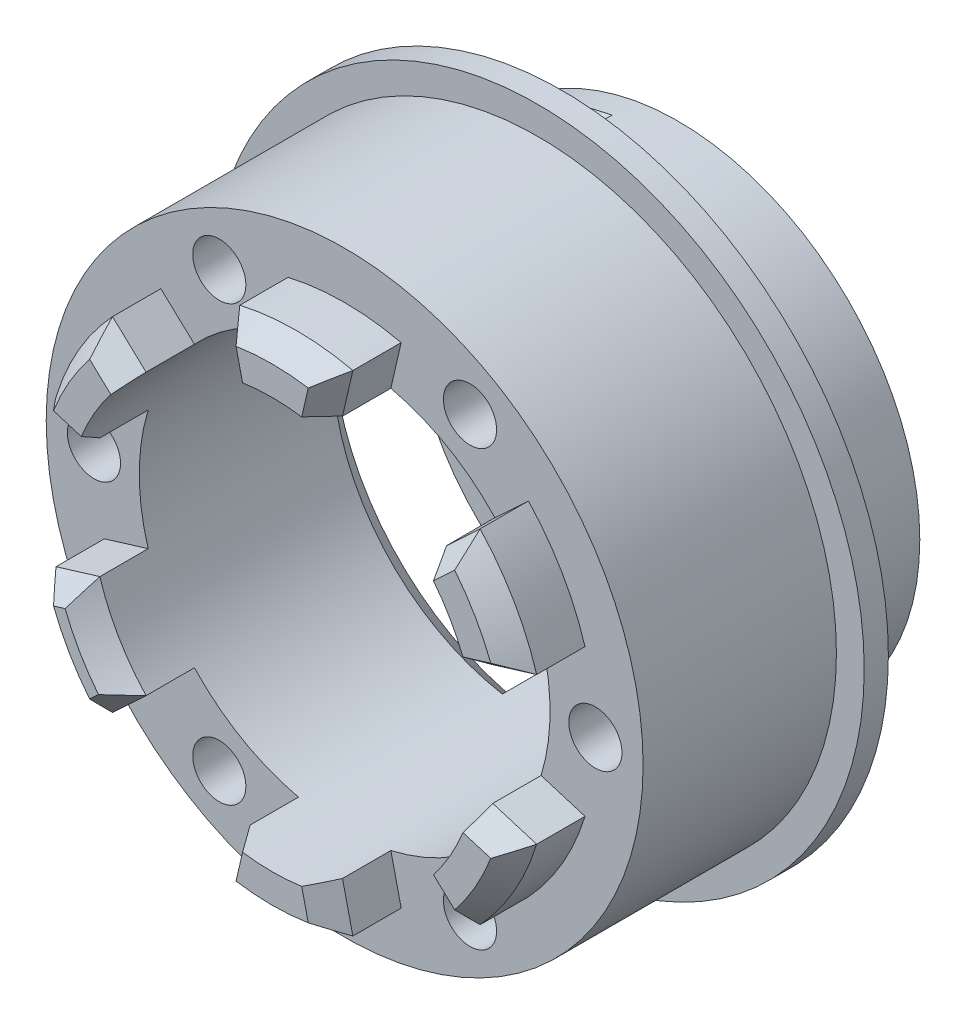
from build123d import *
from OCP.BRepFilletAPI import BRepFilletAPI_MakeChamfer
from build123d.topology import SkipClean

# Parameters (mm, degrees)
SKETCH_1_R          = 10
EXTRUDE_1_DEPTH     = 2
SKETCH_2_R          = 10
SKETCH_2_R_2        = 8.5
EXTRUDE_2_DEPTH     = 2.8
SKETCH_4_R          = 13.5
SKETCH_4_R_2        = 8.5
EXTRUDE_3_DEPTH     = 1
SKETCH_5_R          = 12.35
SKETCH_5_R_2        = 8.5
EXTRUDE_4_DEPTH     = 8
SKETCH_6_R          = 1.1
CUT_EXTRUDE_1_DEPTH = 8
SKETCH_7_R          = 3
SKETCH_7_R_2        = 1.15
CUT_EXTRUDE_2_DEPTH = 24.557164515
EXTRUDE_5_DEPTH     = 3
CHAMFER_1_SIZE      = 1
CHAMFER_1_SIZE2     = 0.700207538
CUT_EXTRUDE_START   = -2
CUT_EXTRUDE_3_DEPTH = 2.8
CHAMFER_2_SIZE      = 1


with BuildPart() as part:
    # 스케치1 → 보스-돌출1 (new body)
    with BuildSketch(Plane.XY):
        Circle(SKETCH_1_R)
    extrude(amount=EXTRUDE_1_DEPTH)

    # 스케치2 → 보스-돌출2 (add)
    with BuildSketch(Plane.XY.offset(2)):
        Circle(SKETCH_2_R)
        Circle(SKETCH_2_R_2, mode=Mode.SUBTRACT)
    extrude(amount=EXTRUDE_2_DEPTH)

    # 스케치4 → 보스-돌출3 (add)
    with BuildSketch(Plane.XY.offset(4.8)):
        Circle(SKETCH_4_R)
        Circle(SKETCH_4_R_2, mode=Mode.SUBTRACT)
    extrude(amount=EXTRUDE_3_DEPTH)

    # 스케치5 → 보스-돌출4 (add)
    with BuildSketch(Plane.XY.offset(5.8)):
        Circle(SKETCH_5_R)
        Circle(SKETCH_5_R_2, mode=Mode.SUBTRACT)
    extrude(amount=EXTRUDE_4_DEPTH)

    # 스케치6 → 컷-돌출1 (cut)
    with BuildSketch(Plane.XY.offset(13.8)):
        with Locations((10.375, 0)):
            Circle(SKETCH_6_R)
        with Locations((5.1875, -8.985013564)):
            Circle(SKETCH_6_R)
        with Locations((-5.1875, -8.985013564)):
            Circle(SKETCH_6_R)
        with Locations((-10.375, 0)):
            Circle(SKETCH_6_R)
        with Locations((-5.1875, 8.985013564)):
            Circle(SKETCH_6_R)
        with Locations((5.1875, 8.985013564)):
            Circle(SKETCH_6_R)
    extrude(amount=-CUT_EXTRUDE_1_DEPTH, mode=Mode.SUBTRACT)

    # 스케치7 → 컷-돌출2 (cut, through all)
    with BuildSketch(Plane(origin=(0, 0, 0), x_dir=(-1, 0, 0), z_dir=(0, 0, -1))):
        Circle(SKETCH_7_R)
        with Locations((-7, 0)):
            Circle(SKETCH_7_R_2)
        with Locations((7, 0)):
            Circle(SKETCH_7_R_2)
        with Locations((0, 7)):
            Circle(SKETCH_7_R_2)
        with Locations((0, -7)):
            Circle(SKETCH_7_R_2)
    extrude(amount=-CUT_EXTRUDE_2_DEPTH, mode=Mode.SUBTRACT)

    # 스케치10 → 보스-돌출5 (add)
    with SkipClean():  # the faces are left unmerged after this step: merging them gives an invalid solid
        with BuildSketch(Plane.XY.offset(13.8)):
            with BuildLine():
                Line((2.339490965, 10.133448674), (1.912083962, 8.282145551))
                ThreePointArc((1.912083962, 8.282145551), (0, 8.5), (-1.912083962, 8.282145551))
                Line((-1.912083962, 8.282145551), (-2.339490965, 10.133448674))
                ThreePointArc((-2.339490965, 10.133448674), (0, 10.4), (2.339490965, 10.133448674))
            make_face()
            with BuildLine():
                Line((7.606078497, 7.092782945), (6.216506464, 5.796986061))
                ThreePointArc((6.216506464, 5.796986061), (7.361215932, 4.25), (8.128590426, 2.48515949))
                Line((8.128590426, 2.48515949), (9.945569462, 3.040665729))
                ThreePointArc((9.945569462, 3.040665729), (9.006664199, 5.2), (7.606078497, 7.092782945))
            make_face()
            with BuildLine():
                Line((9.945569462, -3.040665729), (8.128590426, -2.48515949))
                ThreePointArc((8.128590426, -2.48515949), (7.361215932, -4.25), (6.216506464, -5.796986061))
                Line((6.216506464, -5.796986061), (7.606078497, -7.092782945))
                ThreePointArc((7.606078497, -7.092782945), (9.006664199, -5.2), (9.945569462, -3.040665729))
            make_face()
            with BuildLine():
                Line((2.339490965, -10.133448674), (1.912083962, -8.282145551))
                ThreePointArc((1.912083962, -8.282145551), (0, -8.5), (-1.912083962, -8.282145551))
                Line((-1.912083962, -8.282145551), (-2.339490965, -10.133448674))
                ThreePointArc((-2.339490965, -10.133448674), (0, -10.4), (2.339490965, -10.133448674))
            make_face()
            with BuildLine():
                Line((-7.606078497, -7.092782945), (-6.216506464, -5.796986061))
                ThreePointArc((-6.216506464, -5.796986061), (-7.361215932, -4.25), (-8.128590426, -2.48515949))
                Line((-8.128590426, -2.48515949), (-9.945569462, -3.040665729))
                ThreePointArc((-9.945569462, -3.040665729), (-9.006664199, -5.2), (-7.606078497, -7.092782945))
            make_face()
            with BuildLine():
                Line((-9.945569462, 3.040665729), (-8.128590426, 2.48515949))
                ThreePointArc((-8.128590426, 2.48515949), (-7.361215932, 4.25), (-6.216506464, 5.796986061))
                Line((-6.216506464, 5.796986061), (-7.606078497, 7.092782945))
                ThreePointArc((-7.606078497, 7.092782945), (-9.006664199, 5.2), (-9.945569462, 3.040665729))
            make_face()
        extrude(amount=EXTRUDE_5_DEPTH)

    # 모따기1: one chamfer whose edges measure the first distance from different faces: ONE call of the kernel's chamfer builder (chamfer() names one face for all edges)
    chamfer_1_edges_1 = [part.edges().sort_by_distance(p)[0] for p in [
        (-9.006664199, -5.2, 16.8),
    ]]
    chamfer_1_side_1 = [part.faces().sort_by_distance(p)[0] for p in [
        (-9.006664199, -5.2, 15.3),
    ]]
    chamfer_1_edges_2 = [part.edges().sort_by_distance(p)[0] for p in [
        (0, -10.4, 16.8),
    ]]
    chamfer_1_side_2 = [part.faces().sort_by_distance(p)[0] for p in [
        (0, -10.4, 15.3),
    ]]
    chamfer_1_edges_3 = [part.edges().sort_by_distance(p)[0] for p in [
        (9.006664199, -5.2, 16.8),
    ]]
    chamfer_1_side_3 = [part.faces().sort_by_distance(p)[0] for p in [
        (9.006664199, -5.2, 15.3),
    ]]
    chamfer_1_edges_4 = [part.edges().sort_by_distance(p)[0] for p in [
        (9.006664199, 5.2, 16.8),
    ]]
    chamfer_1_side_4 = [part.faces().sort_by_distance(p)[0] for p in [
        (9.006664199, 5.2, 15.3),
    ]]
    chamfer_1_edges_5 = [part.edges().sort_by_distance(p)[0] for p in [
        (0, 10.4, 16.8),
    ]]
    chamfer_1_side_5 = [part.faces().sort_by_distance(p)[0] for p in [
        (0, 10.4, 15.3),
    ]]
    chamfer_1_edges_6 = [part.edges().sort_by_distance(p)[0] for p in [
        (-9.006664199, 5.2, 16.8),
    ]]
    chamfer_1_side_6 = [part.faces().sort_by_distance(p)[0] for p in [
        (-9.006664199, 5.2, 15.3),
    ]]
    chamfer_1_edges_7 = [part.edges().sort_by_distance(p)[0] for p in [
        (-9.037079944, -2.76291261, 16.8),
    ]]
    chamfer_1_side_7 = [part.faces().sort_by_distance(p)[0] for p in [
        (-9.037079944, -2.76291261, 15.3),
    ]]
    chamfer_1_edges_8 = [part.edges().sort_by_distance(p)[0] for p in [
        (-7.361215932, -4.25, 16.8),
    ]]
    chamfer_1_side_8 = [part.faces().sort_by_distance(p)[0] for p in [
        (-7.361215932, -4.25, 15.3),
    ]]
    chamfer_1_edges_9 = [part.edges().sort_by_distance(p)[0] for p in [
        (-6.91129248, -6.444884503, 16.8),
    ]]
    chamfer_1_side_9 = [part.faces().sort_by_distance(p)[0] for p in [
        (-6.91129248, -6.444884503, 15.3),
    ]]
    chamfer_1_edges_10 = [part.edges().sort_by_distance(p)[0] for p in [
        (2.125787464, -9.207797112, 16.8),
    ]]
    chamfer_1_side_10 = [part.faces().sort_by_distance(p)[0] for p in [
        (2.125787464, -9.207797112, 15.3),
    ]]
    chamfer_1_edges_11 = [part.edges().sort_by_distance(p)[0] for p in [
        (-2.125787464, -9.207797112, 16.8),
    ]]
    chamfer_1_side_11 = [part.faces().sort_by_distance(p)[0] for p in [
        (-2.125787464, -9.207797112, 15.3),
    ]]
    chamfer_1_edges_12 = [part.edges().sort_by_distance(p)[0] for p in [
        (6.91129248, -6.444884503, 16.8),
    ]]
    chamfer_1_side_12 = [part.faces().sort_by_distance(p)[0] for p in [
        (6.91129248, -6.444884503, 15.3),
    ]]
    chamfer_1_edges_13 = [part.edges().sort_by_distance(p)[0] for p in [
        (9.037079944, -2.76291261, 16.8),
    ]]
    chamfer_1_side_13 = [part.faces().sort_by_distance(p)[0] for p in [
        (9.037079944, -2.76291261, 15.3),
    ]]
    chamfer_1_edges_14 = [part.edges().sort_by_distance(p)[0] for p in [
        (9.037079944, 2.76291261, 16.8),
    ]]
    chamfer_1_side_14 = [part.faces().sort_by_distance(p)[0] for p in [
        (9.037079944, 2.76291261, 15.3),
    ]]
    chamfer_1_edges_15 = [part.edges().sort_by_distance(p)[0] for p in [
        (6.91129248, 6.444884503, 16.8),
    ]]
    chamfer_1_side_15 = [part.faces().sort_by_distance(p)[0] for p in [
        (6.91129248, 6.444884503, 15.3),
    ]]
    chamfer_1_edges_16 = [part.edges().sort_by_distance(p)[0] for p in [
        (2.125787464, 9.207797112, 16.8),
    ]]
    chamfer_1_side_16 = [part.faces().sort_by_distance(p)[0] for p in [
        (2.125787464, 9.207797112, 15.3),
    ]]
    chamfer_1_edges_17 = [part.edges().sort_by_distance(p)[0] for p in [
        (-2.125787464, 9.207797112, 16.8),
    ]]
    chamfer_1_side_17 = [part.faces().sort_by_distance(p)[0] for p in [
        (-2.125787464, 9.207797112, 15.3),
    ]]
    chamfer_1_edges_18 = [part.edges().sort_by_distance(p)[0] for p in [
        (-9.037079944, 2.76291261, 16.8),
    ]]
    chamfer_1_side_18 = [part.faces().sort_by_distance(p)[0] for p in [
        (-9.037079944, 2.76291261, 15.3),
    ]]
    chamfer_1_edges_19 = [part.edges().sort_by_distance(p)[0] for p in [
        (-6.91129248, 6.444884503, 16.8),
    ]]
    chamfer_1_side_19 = [part.faces().sort_by_distance(p)[0] for p in [
        (-6.91129248, 6.444884503, 15.3),
    ]]
    chamfer_1 = BRepFilletAPI_MakeChamfer(part.part.solid().wrapped)
    for e in chamfer_1_edges_1:
        chamfer_1.Add(CHAMFER_1_SIZE, CHAMFER_1_SIZE2, e.wrapped, chamfer_1_side_1[0].wrapped)  # the first distance lies on this face
    for e in chamfer_1_edges_2:
        chamfer_1.Add(CHAMFER_1_SIZE, CHAMFER_1_SIZE2, e.wrapped, chamfer_1_side_2[0].wrapped)  # the first distance lies on this face
    for e in chamfer_1_edges_3:
        chamfer_1.Add(CHAMFER_1_SIZE, CHAMFER_1_SIZE2, e.wrapped, chamfer_1_side_3[0].wrapped)  # the first distance lies on this face
    for e in chamfer_1_edges_4:
        chamfer_1.Add(CHAMFER_1_SIZE, CHAMFER_1_SIZE2, e.wrapped, chamfer_1_side_4[0].wrapped)  # the first distance lies on this face
    for e in chamfer_1_edges_5:
        chamfer_1.Add(CHAMFER_1_SIZE, CHAMFER_1_SIZE2, e.wrapped, chamfer_1_side_5[0].wrapped)  # the first distance lies on this face
    for e in chamfer_1_edges_6:
        chamfer_1.Add(CHAMFER_1_SIZE, CHAMFER_1_SIZE2, e.wrapped, chamfer_1_side_6[0].wrapped)  # the first distance lies on this face
    for e in chamfer_1_edges_7:
        chamfer_1.Add(CHAMFER_1_SIZE, CHAMFER_1_SIZE2, e.wrapped, chamfer_1_side_7[0].wrapped)  # the first distance lies on this face
    for e in chamfer_1_edges_8:
        chamfer_1.Add(CHAMFER_1_SIZE, CHAMFER_1_SIZE2, e.wrapped, chamfer_1_side_8[0].wrapped)  # the first distance lies on this face
    for e in chamfer_1_edges_9:
        chamfer_1.Add(CHAMFER_1_SIZE, CHAMFER_1_SIZE2, e.wrapped, chamfer_1_side_9[0].wrapped)  # the first distance lies on this face
    for e in chamfer_1_edges_10:
        chamfer_1.Add(CHAMFER_1_SIZE, CHAMFER_1_SIZE2, e.wrapped, chamfer_1_side_10[0].wrapped)  # the first distance lies on this face
    for e in chamfer_1_edges_11:
        chamfer_1.Add(CHAMFER_1_SIZE, CHAMFER_1_SIZE2, e.wrapped, chamfer_1_side_11[0].wrapped)  # the first distance lies on this face
    for e in chamfer_1_edges_12:
        chamfer_1.Add(CHAMFER_1_SIZE, CHAMFER_1_SIZE2, e.wrapped, chamfer_1_side_12[0].wrapped)  # the first distance lies on this face
    for e in chamfer_1_edges_13:
        chamfer_1.Add(CHAMFER_1_SIZE, CHAMFER_1_SIZE2, e.wrapped, chamfer_1_side_13[0].wrapped)  # the first distance lies on this face
    for e in chamfer_1_edges_14:
        chamfer_1.Add(CHAMFER_1_SIZE, CHAMFER_1_SIZE2, e.wrapped, chamfer_1_side_14[0].wrapped)  # the first distance lies on this face
    for e in chamfer_1_edges_15:
        chamfer_1.Add(CHAMFER_1_SIZE, CHAMFER_1_SIZE2, e.wrapped, chamfer_1_side_15[0].wrapped)  # the first distance lies on this face
    for e in chamfer_1_edges_16:
        chamfer_1.Add(CHAMFER_1_SIZE, CHAMFER_1_SIZE2, e.wrapped, chamfer_1_side_16[0].wrapped)  # the first distance lies on this face
    for e in chamfer_1_edges_17:
        chamfer_1.Add(CHAMFER_1_SIZE, CHAMFER_1_SIZE2, e.wrapped, chamfer_1_side_17[0].wrapped)  # the first distance lies on this face
    for e in chamfer_1_edges_18:
        chamfer_1.Add(CHAMFER_1_SIZE, CHAMFER_1_SIZE2, e.wrapped, chamfer_1_side_18[0].wrapped)  # the first distance lies on this face
    for e in chamfer_1_edges_19:
        chamfer_1.Add(CHAMFER_1_SIZE, CHAMFER_1_SIZE2, e.wrapped, chamfer_1_side_19[0].wrapped)  # the first distance lies on this face
    add(Compound.cast(chamfer_1.Shape()), mode=Mode.REPLACE)

    # 스케치11 → 컷-돌출3 (cut)
    with BuildSketch(Plane(origin=(0, 0, 0), x_dir=(-1, 0, 0), z_dir=(0, 0, -1)).offset(CUT_EXTRUDE_START)):
        with BuildLine():
            Line((1.736481777, 9.84807753), (0.520944533, 2.954423259))
            ThreePointArc((0.520944533, 2.954423259), (2.298133329, 1.928362829), (3, 0))
            Line((3, 0), (5.85, 0))
            ThreePointArc((5.85, 0), (7, 1.15), (8.15, 0))
            Line((8.15, 0), (10, 0))
            ThreePointArc((10, 0), (7.660444431, 6.427876097), (1.736481777, 9.84807753))
        make_face()
        with BuildLine():
            ThreePointArc((3, 0), (2.298133329, -1.928362829), (0.520944533, -2.954423259))
            Line((0.520944533, -2.954423259), (1.736481777, -9.84807753))
            ThreePointArc((1.736481777, -9.84807753), (7.660444431, -6.427876097), (10, 0))
            Line((10, 0), (8.15, 0))
            ThreePointArc((8.15, 0), (7, -1.15), (5.85, 0))
            Line((5.85, 0), (3, 0))
        make_face()
    extrude(amount=-CUT_EXTRUDE_3_DEPTH, mode=Mode.SUBTRACT)

    # 모따기2
    chamfer_2_edges = [part.edges().sort_by_distance(p)[0] for p in [
        (-8.5, 0, 4.8),
        (-10, 0, 2),
    ]]
    chamfer(chamfer_2_edges, length=CHAMFER_2_SIZE)


solid = part.part
